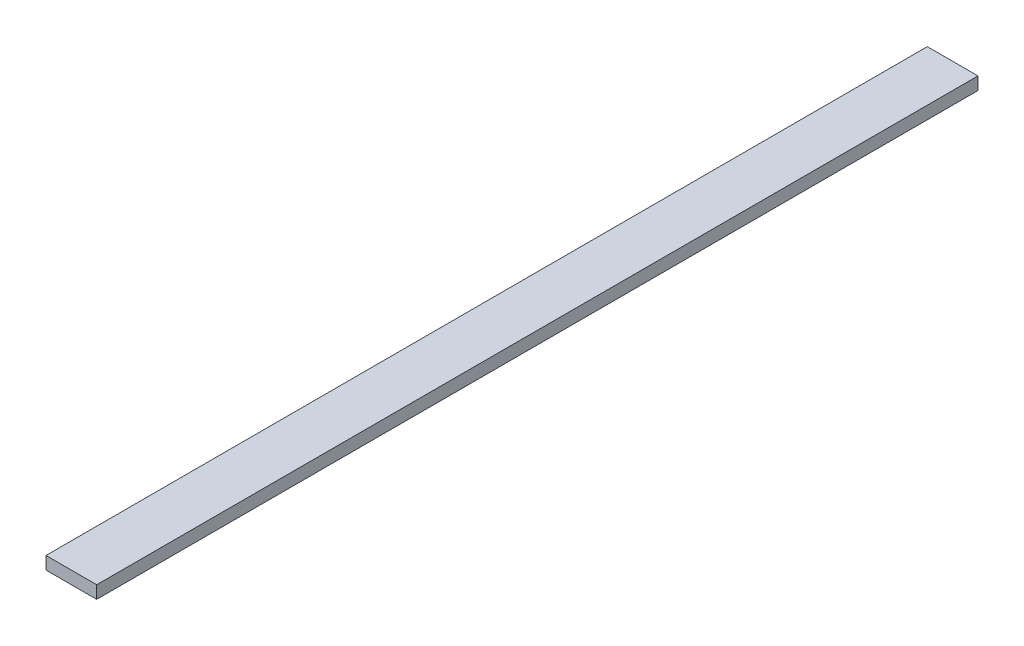
from build123d import *

# Parameters (mm, degrees)
SKETCH1_W           = 4
SKETCH1_H           = 69.55
BOSS_EXTRUDE1_DEPTH = 1


with BuildPart() as part:
    # Sketch1 → Boss-Extrude1 (new body)
    with BuildSketch(Plane(origin=(0, 0, 0), x_dir=(1, 0, 0), z_dir=(0, 1, 0))):
        with Locations((2, -34.775)):
            Rectangle(SKETCH1_W, SKETCH1_H)
    extrude(amount=BOSS_EXTRUDE1_DEPTH)


solid = part.part
